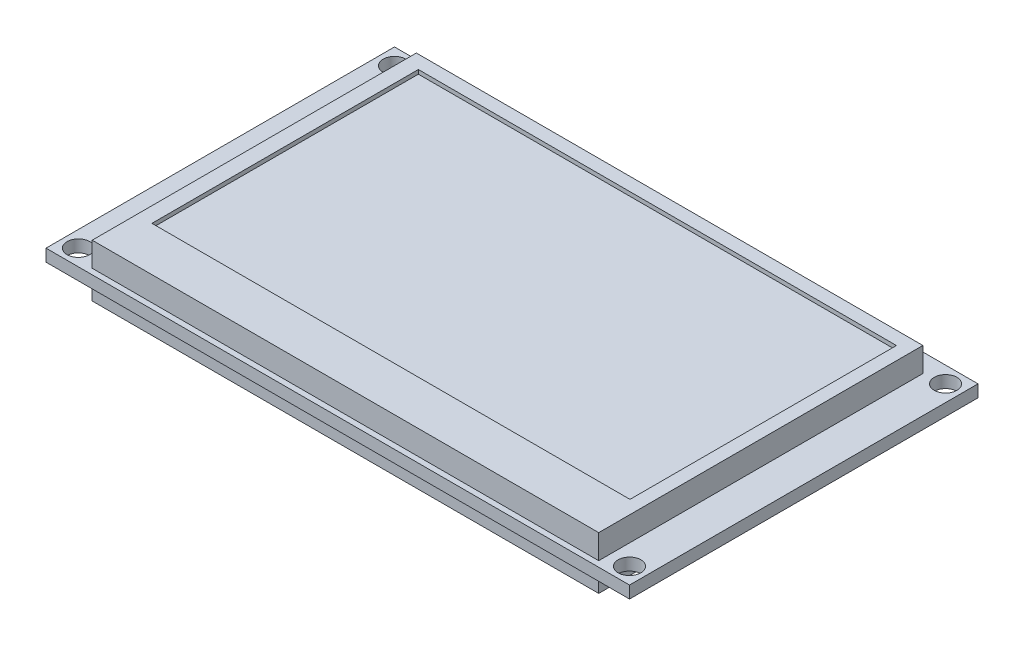
from build123d import *

# Parameters (mm, degrees)
SKETCH2_W           = 72
SKETCH2_H           = 43
BOSS_EXTRUDE1_DEPTH = 1.5
SKETCH3_R           = 1.4
CUT_EXTRUDE1_DEPTH  = 84.876397157
SKETCH4_W           = 62.5
SKETCH4_H           = 40
BOSS_EXTRUDE2_DEPTH = 3
SKETCH4_2_W         = 62.5
SKETCH4_2_H         = 40
BOSS_EXTRUDE3_DEPTH = 3.5
SKETCH8_W           = 58.989740066
SKETCH8_H           = 32.879527249
CUT_EXTRUDE2_DEPTH  = 0.5


with BuildPart() as part:
    # Sketch2 → Boss-Extrude1 (new body)
    with BuildSketch(Plane(origin=(0, 0, 0), x_dir=(1, 0, 0), z_dir=(0, 1, 0))):
        with Locations((36, 21.5)):
            Rectangle(SKETCH2_W, SKETCH2_H)
    extrude(amount=BOSS_EXTRUDE1_DEPTH)

    # Sketch3 → Cut-Extrude1 (cut, through all)
    with BuildSketch(Plane(origin=(0, 1.5, 0), x_dir=(1, 0, 0), z_dir=(0, 1, 0))):
        with Locations((2, 41)):
            Circle(SKETCH3_R)
        with Locations((70, 41)):
            Circle(SKETCH3_R)
        with Locations((2, 2)):
            Circle(SKETCH3_R)
        with Locations((70, 2)):
            Circle(SKETCH3_R)
    extrude(amount=-CUT_EXTRUDE1_DEPTH, mode=Mode.SUBTRACT)

    # Sketch4 → Boss-Extrude2 (add)
    with BuildSketch(Plane(origin=(0, 1.5, 0), x_dir=(1, 0, 0), z_dir=(0, 1, 0))):
        with Locations((36.25, 20.7)):
            Rectangle(SKETCH4_W, SKETCH4_H)
    extrude(amount=BOSS_EXTRUDE2_DEPTH)

    # Sketch4<2> → Boss-Extrude3 (add)
    with BuildSketch(Plane(origin=(0, 1.5, 0), x_dir=(1, 0, 0), z_dir=(0, 1, 0))):
        with Locations((36.25, 20.7)):
            Rectangle(SKETCH4_2_W, SKETCH4_2_H)
    extrude(amount=-BOSS_EXTRUDE3_DEPTH)

    # Sketch8 → Cut-Extrude2 (cut)
    with BuildSketch(Plane(origin=(0, 4.5, 0), x_dir=(1, 0, 0), z_dir=(0, 1, 0))):
        with Locations((36.379910504, 22.622462852)):
            Rectangle(SKETCH8_W, SKETCH8_H)
    extrude(amount=-CUT_EXTRUDE2_DEPTH, mode=Mode.SUBTRACT)


solid = part.part
